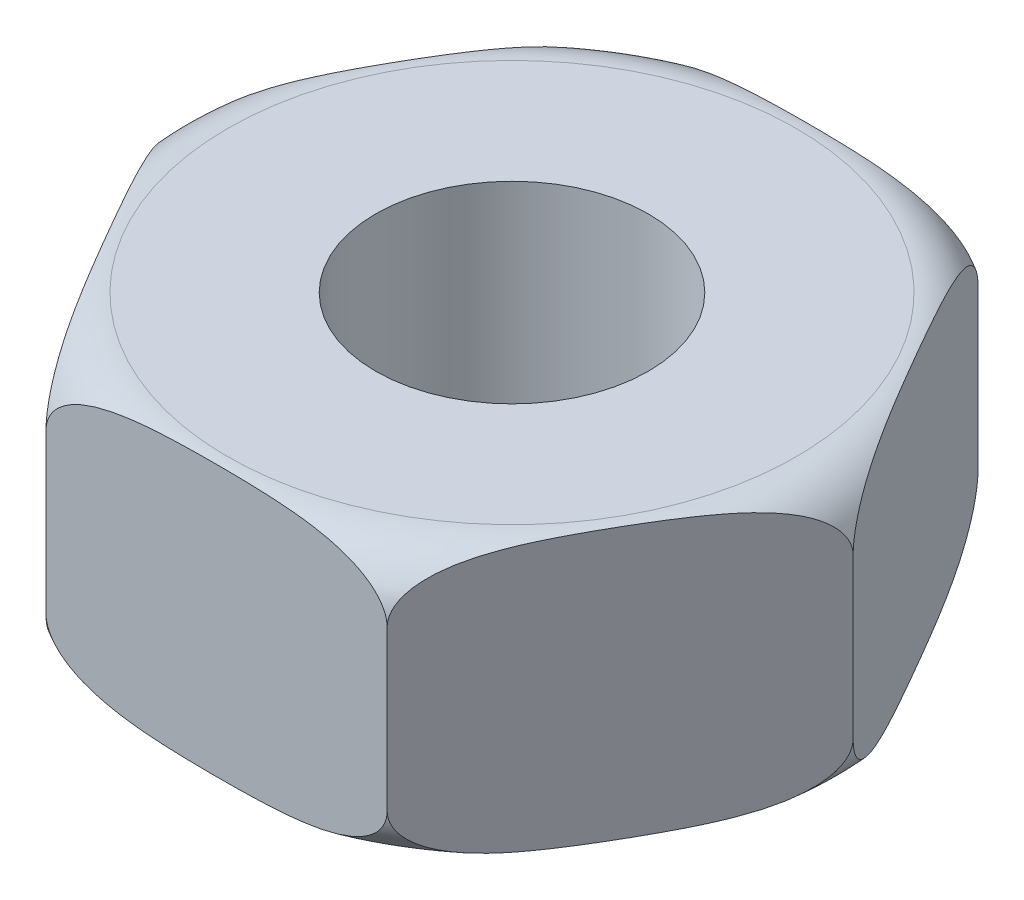
from build123d import *

# Parameters (mm, degrees)
BOSS_EXTRUDE1_DEPTH    = 12
F_12_0MM_DOWEL_HOLE1_D = 12


with BuildPart() as part:
    # Sketch1 → Boss-Extrude1 (new body)
    with BuildSketch(Plane(origin=(0, 0, 0), x_dir=(1, 0, 0), z_dir=(0, 1, 0))):
        Polygon((7.505553499, 13), (-7.505553499, 13), (-15.011106999, 0), (-7.505553499, -13), (7.505553499, -13), (15.011106999, 0), align=None)
    extrude(amount=BOSS_EXTRUDE1_DEPTH)

    # Ø12.0mm Dowel Hole1 (through all)
    with Locations(Plane(origin=(0, 0, 0), x_dir=(-1, 0, 0), z_dir=(0, -1, 0))):
        with Locations((0, 0)):
            Hole(F_12_0MM_DOWEL_HOLE1_D / 2)

    # Sketch4 → Cut-Revolve2 (revolve, cut)
    with BuildSketch(Plane.XY, mode=Mode.PRIVATE) as cut_revolve2_sk:
        with BuildLine():
            Line((19.381381373, -4.532480394), (19.381381373, 2.5))
            Line((19.381381373, 2.5), (15.011106999, 2.5))
            ThreePointArc((15.011106999, 2.5), (14.278873952, 0.732233047), (12.511106999, 0))
            Line((12.511106999, 0), (12.511106999, -4.532480394))
            Line((12.511106999, -4.532480394), (19.381381373, -4.532480394))
        make_face()
    cut_revolve2 = revolve(cut_revolve2_sk.sketch.rotate(Axis((0, 14.406395282, 0), (0, -1, 0)), 270), axis=Axis((0, 14.406395282, 0), (0, -1, 0)), mode=Mode.SUBTRACT)

    # Mirror1: Cut-Revolve2 across plane
    add(cut_revolve2.mirror(Plane(origin=(0, 6, 0), x_dir=(0, 0, 1), z_dir=(0, -1, 0))), mode=Mode.SUBTRACT)


solid = part.part
